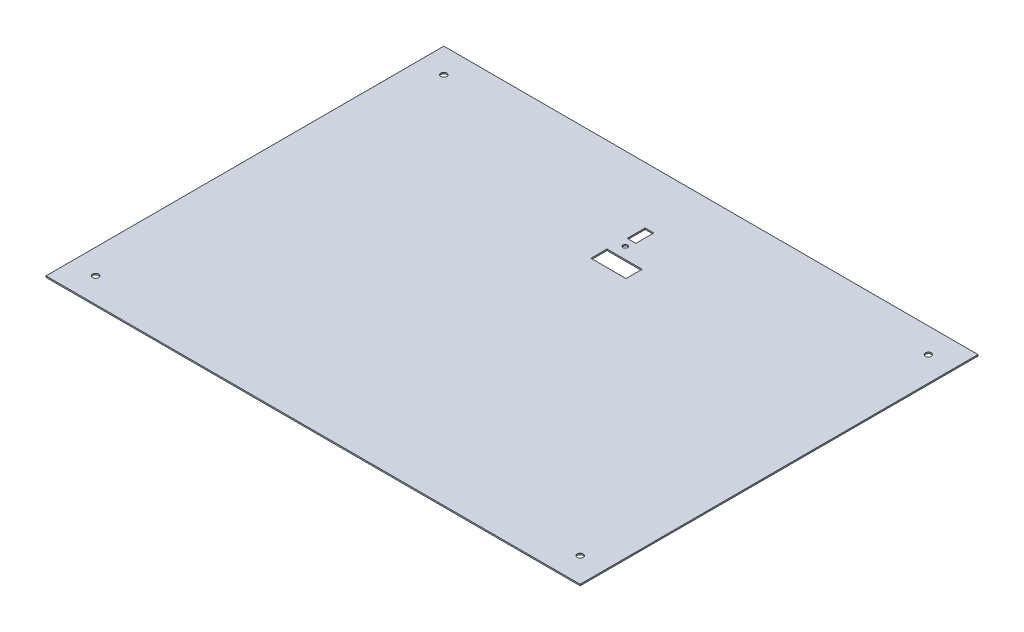
from build123d import *

# Parameters (mm, degrees)
SKETCH1_W           = 388
SKETCH1_H           = 283
SKETCH1_R           = 2.2
BOSS_EXTRUDE1_DEPTH = 1
SKETCH3_W           = 388
SKETCH3_H           = 6
BOSS_EXTRUDE2_DEPTH = 1
CUT_EXTRUDE1_REACH  = 245.707
SKETCH2_R           = 1.7
SKETCH2_W           = 6.249732698
SKETCH2_H           = 13.035291303
SKETCH2_W_2         = 25.5
SKETCH2_H_2         = 11.652706254


with BuildPart() as part:
    # Sketch1 → Boss-Extrude1 (new body)
    with BuildSketch(Plane(origin=(0, 0, 0), x_dir=(1, 0, 0), z_dir=(0, 1, 0))):
        Rectangle(SKETCH1_W, SKETCH1_H)
        with Locations(Location((-176, -129.5, 0), (0, 0, 270))):
            Circle(SKETCH1_R, mode=Mode.SUBTRACT)
        with Locations(Location((-176, 123.5, 0), (0, 0, 270))):
            Circle(SKETCH1_R, mode=Mode.SUBTRACT)
        with Locations(Location((176, 123.5, 0), (0, 0, 90))):
            Circle(SKETCH1_R, mode=Mode.SUBTRACT)
        with Locations(Location((176, -129.5, 0), (0, 0, 90))):
            Circle(SKETCH1_R, mode=Mode.SUBTRACT)
    extrude(amount=BOSS_EXTRUDE1_DEPTH)

    # Sketch3 → Boss-Extrude2 (add)
    with BuildSketch(Plane(origin=(0, 1, 0), x_dir=(1, 0, 0), z_dir=(0, 1, 0))):
        with Locations((0, -144.5)):
            Rectangle(SKETCH3_W, SKETCH3_H)
    extrude(amount=-BOSS_EXTRUDE2_DEPTH)

    # Sketch2 → Cut-Extrude1 (cut, up to next)
    with BuildSketch(Plane(origin=(0, 1, 0), x_dir=(1, 0, 0), z_dir=(0, 1, 0)), mode=Mode.PRIVATE) as cut_extrude1_sk1:
        with Locations(Location((-2.151296326, 81.503031076, 0), (0, 0, 270))):
            Circle(SKETCH2_R)
    cut_extrude1_tool1 = extrude(cut_extrude1_sk1.sketch, amount=-CUT_EXTRUDE1_REACH, mode=Mode.PRIVATE) & part.part
    # Sketch2 → Cut-Extrude1 (cut, up to next)
    with BuildSketch(Plane(origin=(0, 1, 0), x_dir=(1, 0, 0), z_dir=(0, 1, 0)), mode=Mode.PRIVATE) as cut_extrude1_sk2:
        with Locations((-3.381291093, 93.709879219)):
            Rectangle(SKETCH2_W, SKETCH2_H)
    cut_extrude1_tool2 = extrude(cut_extrude1_sk2.sketch, amount=-CUT_EXTRUDE1_REACH, mode=Mode.PRIVATE) & part.part
    # Sketch2 → Cut-Extrude1 (cut, up to next)
    with BuildSketch(Plane(origin=(0, 1, 0), x_dir=(1, 0, 0), z_dir=(0, 1, 0)), mode=Mode.PRIVATE) as cut_extrude1_sk3:
        with Locations((5.598703674, 67.329384203)):
            Rectangle(SKETCH2_W_2, SKETCH2_H_2)
    cut_extrude1_tool3 = extrude(cut_extrude1_sk3.sketch, amount=-CUT_EXTRUDE1_REACH, mode=Mode.PRIVATE) & part.part
    add(cut_extrude1_tool1.solids().sort_by_distance((-2.151296, 1, -81.503031))[0], mode=Mode.SUBTRACT)
    add(cut_extrude1_tool2.solids().sort_by_distance((-3.381291, 1, -93.709879))[0], mode=Mode.SUBTRACT)
    add(cut_extrude1_tool3.solids().sort_by_distance((5.598704, 1, -67.329384))[0], mode=Mode.SUBTRACT)


solid = part.part
